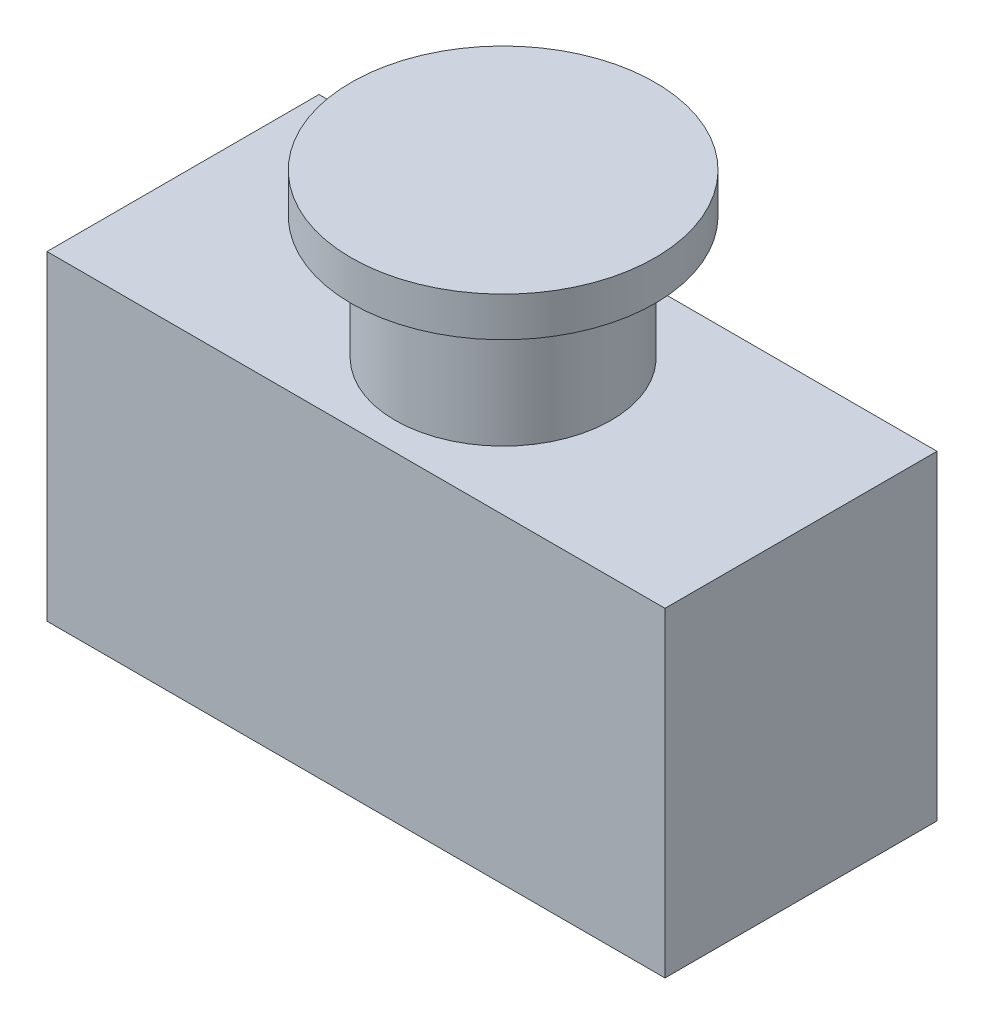
from build123d import *

# Parameters (mm, degrees)
SKETCH1_W      = 309.88
SKETCH1_H      = 136.398
EXTRUDE1_DEPTH = 160.528
SKETCH2_R      = 54.23826071
EXTRUDE2_DEPTH = 81.534
SKETCH3_R      = 76.2
EXTRUDE3_DEPTH = 19.812


with BuildPart() as part:
    # Sketch1 → Extrude1 (new body)
    with BuildSketch(Plane(origin=(0, 0, 0), x_dir=(1, 0, 0), z_dir=(0, 1, 0))):
        with Locations((120.827186097, -35.645984436)):
            Rectangle(SKETCH1_W, SKETCH1_H)
    extrude(amount=EXTRUDE1_DEPTH)

    # Sketch2 → Extrude2 (add)
    with BuildSketch(Plane(origin=(0, 160.528, 0), x_dir=(1, 0, 0), z_dir=(0, 1, 0))):
        with Locations(Location((126.415186097, -35.645984436, 0), (0, 0, 270))):
            Circle(SKETCH2_R)
    extrude(amount=EXTRUDE2_DEPTH)

    # Sketch3 → Extrude3 (add)
    with BuildSketch(Plane(origin=(0, 242.062, 0), x_dir=(1, 0, 0), z_dir=(0, 1, 0))):
        with Locations(Location((126.415186097, -35.645984436, 0), (0, 0, 270))):
            Circle(SKETCH3_R)
    extrude(amount=-EXTRUDE3_DEPTH)


solid = part.part
